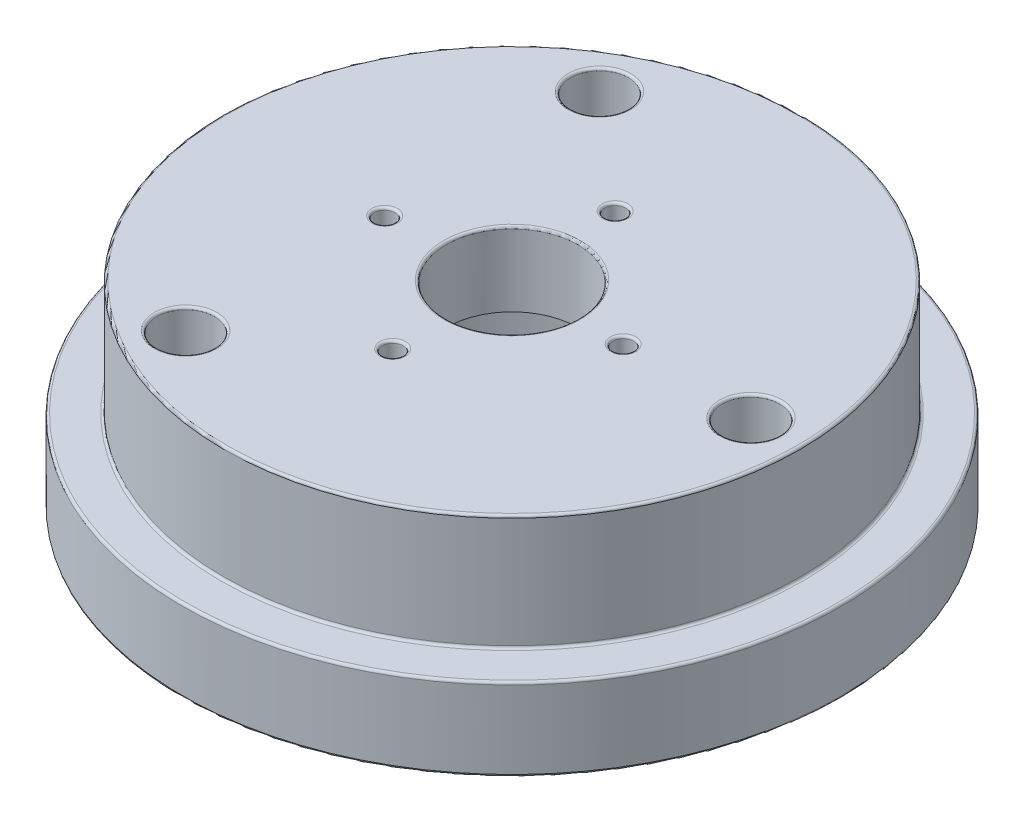
from build123d import *

# Parameters (mm, degrees)
SKETCH2_R          = 1.75
SKETCH2_R_2        = 4
SKETCH2_R_3        = 0.625
CUT_EXTRUDE2_DEPTH = 31.724582991
SKETCH2_4_R        = 10
SKETCH2_4_R_2      = 4
SKETCH2_4_R_3      = 0.625
SKETCH2_4_R_4      = 1.75
CUT_EXTRUDE3_DEPTH = 7.5
FILLET1_R          = 0.15


with BuildPart() as part:
    # Sketch1 → Revolve1 (revolve)
    with BuildSketch(Plane.XY):
        Polygon((0, 0), (-20, 0), (-20, 5), (-17.5, 5), (-17.5, 12), (0, 12), align=None)
    revolve(axis=Axis((0, 12, 0), (0, -1, 0)))

    # Sketch2 → Cut-Extrude2 (cut, through all)
    with BuildSketch(Plane.XZ):
        with Locations((14.5, 0)):
            Circle(SKETCH2_R)
        with Locations((-7.25, -12.557368355)):
            Circle(SKETCH2_R)
        with Locations((-7.25, 12.557368355)):
            Circle(SKETCH2_R)
        Circle(SKETCH2_R_2)
        with Locations((6.75, 0)):
            Circle(SKETCH2_R_3)
        with Locations((-0.491374179, -6.75)):
            Circle(SKETCH2_R_3)
        with Locations((-7.241374179, 0.491374179)):
            Circle(SKETCH2_R_3)
        with Locations((0, 7.241374179)):
            Circle(SKETCH2_R_3)
    extrude(amount=-CUT_EXTRUDE2_DEPTH, mode=Mode.SUBTRACT)

    # Sketch2<4> → Cut-Extrude3 (cut)
    # profile 1 of 4: a face of its own
    with BuildSketch(Plane.XZ):
        Circle(SKETCH2_4_R)
        Circle(SKETCH2_4_R_2, mode=Mode.SUBTRACT)
        with Locations((6.75, 0)):
            Circle(SKETCH2_4_R_3, mode=Mode.SUBTRACT)
        with Locations((-0.491374179, -6.75)):
            Circle(SKETCH2_4_R_3, mode=Mode.SUBTRACT)
        with Locations((-7.241374179, 0.491374179)):
            Circle(SKETCH2_4_R_3, mode=Mode.SUBTRACT)
        with Locations((0, 7.241374179)):
            Circle(SKETCH2_4_R_3, mode=Mode.SUBTRACT)
    # profile 2 of 4: a face of its own
    with BuildSketch(Plane.XZ):
        with Locations((14.5, 0)):
            Circle(SKETCH2_4_R_4)
    # profile 3 of 4: a face of its own
    with BuildSketch(Plane.XZ):
        with Locations((-7.25, -12.557368355)):
            Circle(SKETCH2_4_R_4)
    # profile 4 of 4: a face of its own
    with BuildSketch(Plane.XZ):
        with Locations((-7.25, 12.557368355)):
            Circle(SKETCH2_4_R_4)
    extrude(amount=-CUT_EXTRUDE3_DEPTH, mode=Mode.SUBTRACT)

    # Fillet1
    fillet1_edges = [part.edges().sort_by_distance(p)[0] for p in [
        (17.5, 5, 0),
        (20, 5, 0),
        (17.5, 12, 0),
        (-9, 12, 12.557368355),
        (-7.866374179, 12, 0.491374179),
        (-1.116374179, 12, -6.75),
        (12.75, 12, 0),
        (-4, 12, 0),
        (-9, 12, -12.557368355),
        (6.125, 12, 0),
        (-0.625, 12, 7.241374179),
        (20, 0, 0),
        (-9, 0, 12.557368355),
        (12.75, 0, 0),
        (-9, 0, -12.557368355),
        (-10, 0, 0),
    ]]
    fillet(fillet1_edges, radius=FILLET1_R)


solid = part.part
